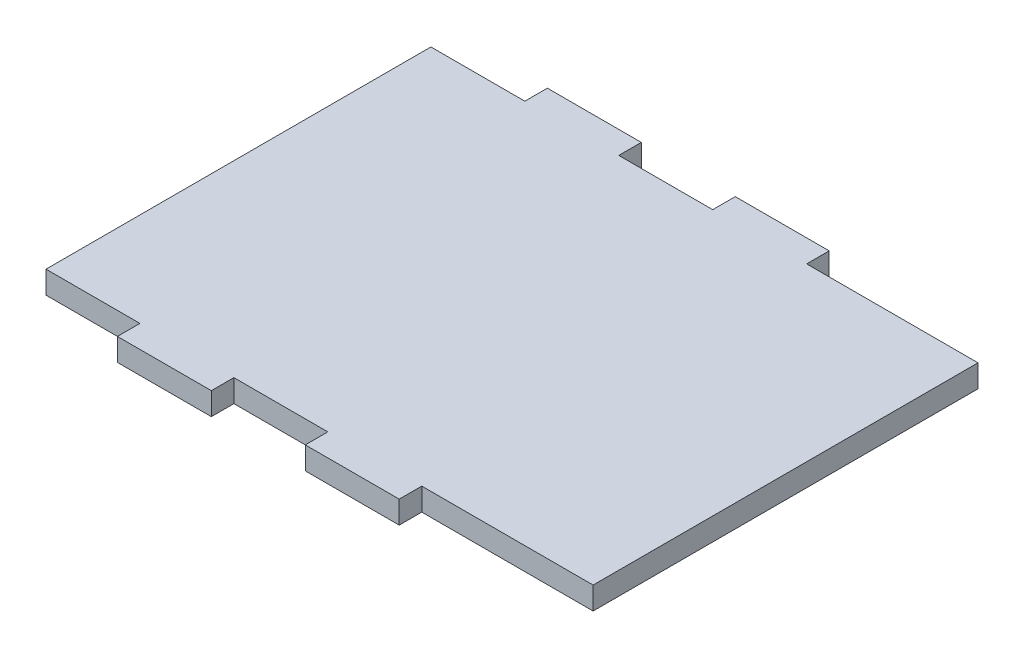
from build123d import *

# Parameters (mm, degrees)
EXTRUDE_1_DEPTH = 6


with BuildPart() as part:
    # Эскиз1 → Бобышка-Вытянуть1 (new body)
    with BuildSketch(Plane(origin=(0, 0, 0), x_dir=(1, 0, 0), z_dir=(0, 1, 0))):
        Polygon((27.2, -57.215), (27.2, -51.215), (72.8, -51.215), (72.8, 51.215), (27.2, 51.215), (27.2, 57.215), (2.2, 57.215), (2.2, 51.215), (-22.8, 51.215), (-22.8, 57.215), (-47.8, 57.215), (-47.8, 51.215), (-72.8, 51.215), (-72.8, -51.215), (-47.8, -51.215), (-47.8, -57.215), (-22.8, -57.215), (-22.8, -51.215), (2.2, -51.215), (2.2, -57.215), align=None)
    extrude(amount=EXTRUDE_1_DEPTH)


solid = part.part
